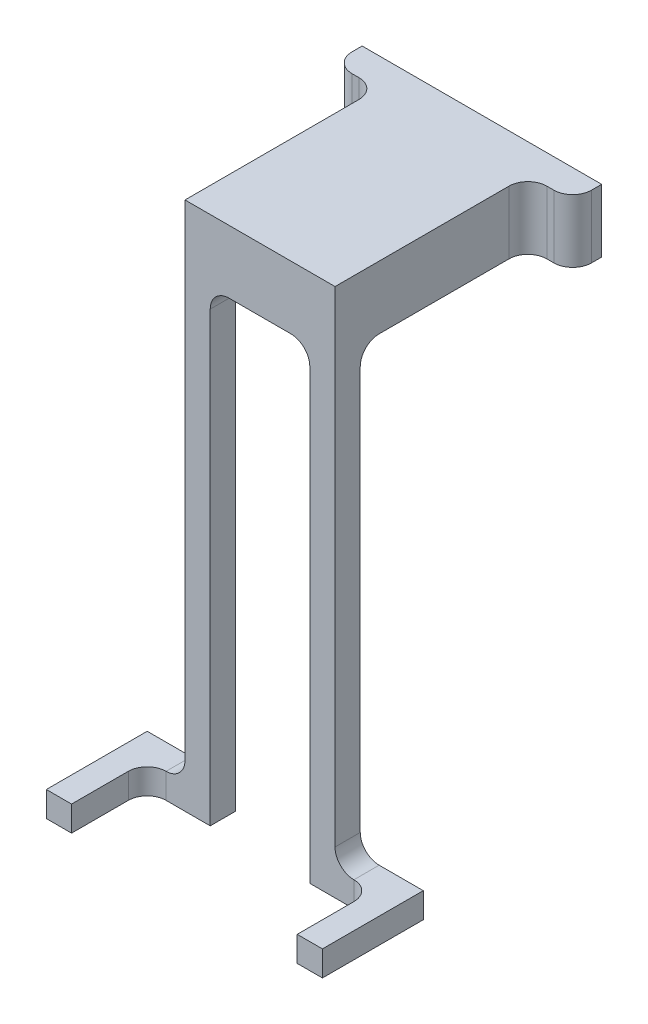
from build123d import *

# Parameters (mm, degrees)
BOSS_EXTRUDE1_DEPTH = 5
SKETCH2_W           = 2
SKETCH2_H           = 2
BOSS_EXTRUDE2_DEPTH = 37
SKETCH3_W           = 2
SKETCH3_H           = 2
BOSS_EXTRUDE3_DEPTH = 5
SKETCH4_W           = 2
SKETCH4_H           = 2
BOSS_EXTRUDE4_DEPTH = 5
SKETCH5_W           = 2
SKETCH5_H           = 2
BOSS_EXTRUDE5_DEPTH = 6
FILLET2_R           = 1.5
FILLET3_R           = 1.5


with BuildPart() as part:
    # Sketch1 → Boss-Extrude1 (new body)
    with BuildSketch(Plane(origin=(0, 0, 0), x_dir=(1, 0, 0), z_dir=(0, 1, 0))):
        Polygon((-9.5, 2.3), (9.5, 2.3), (9.5, 0), (5.95, 0), (5.95, -15.3), (-5.95, -15.3), (-5.95, 0), (-9.5, 0), align=None)
    extrude(amount=BOSS_EXTRUDE1_DEPTH)

    # Sketch2 → Boss-Extrude2 (add)
    with BuildSketch(Plane.XZ):
        with Locations((-4.95, 14.3)):
            Rectangle(SKETCH2_W, SKETCH2_H)
        with Locations((4.95, 14.3)):
            Rectangle(SKETCH2_W, SKETCH2_H)
    extrude(amount=BOSS_EXTRUDE2_DEPTH)

    # Sketch3 → Boss-Extrude3 (add)
    with BuildSketch(Plane.ZY.offset(5.95)):
        with Locations((14.3, -36)):
            Rectangle(SKETCH3_W, SKETCH3_H)
    extrude(amount=BOSS_EXTRUDE3_DEPTH)

    # Sketch4 → Boss-Extrude4 (add)
    with BuildSketch(Plane(origin=(5.95, 0, 0), x_dir=(0, 0, -1), z_dir=(1, 0, 0))):
        with Locations((-14.3, -36)):
            Rectangle(SKETCH4_W, SKETCH4_H)
    extrude(amount=BOSS_EXTRUDE4_DEPTH)

    # Sketch5 → Boss-Extrude5 (add)
    with BuildSketch(Plane.XY.offset(15.3)):
        with Locations((-9.95, -36)):
            Rectangle(SKETCH5_W, SKETCH5_H)
        with Locations((9.95, -36)):
            Rectangle(SKETCH5_W, SKETCH5_H)
    extrude(amount=BOSS_EXTRUDE5_DEPTH)

    # Fillet2
    fillet2_edges = [part.edges().sort_by_distance(p)[0] for p in [
        (-9.5, 2.5, 0),
        (-5.95, 2.5, 0),
        (9.5, 2.5, 0),
        (5.95, 2.5, 0),
        (-5.95, -35, 14.3),
        (5.95, -35, 14.3),
        (-4.95, 0, 13.3),
        (-3.95, 0, 14.3),
        (3.95, 0, 14.3),
        (4.95, 0, 13.3),
    ]]
    fillet(fillet2_edges, radius=FILLET2_R)

    # Fillet3
    fillet3_edges = [part.edges().sort_by_distance(p)[0] for p in [
        (-8.95, -36, 15.3),
        (8.95, -36, 15.3),
    ]]
    fillet(fillet3_edges, radius=FILLET3_R)


solid = part.part
